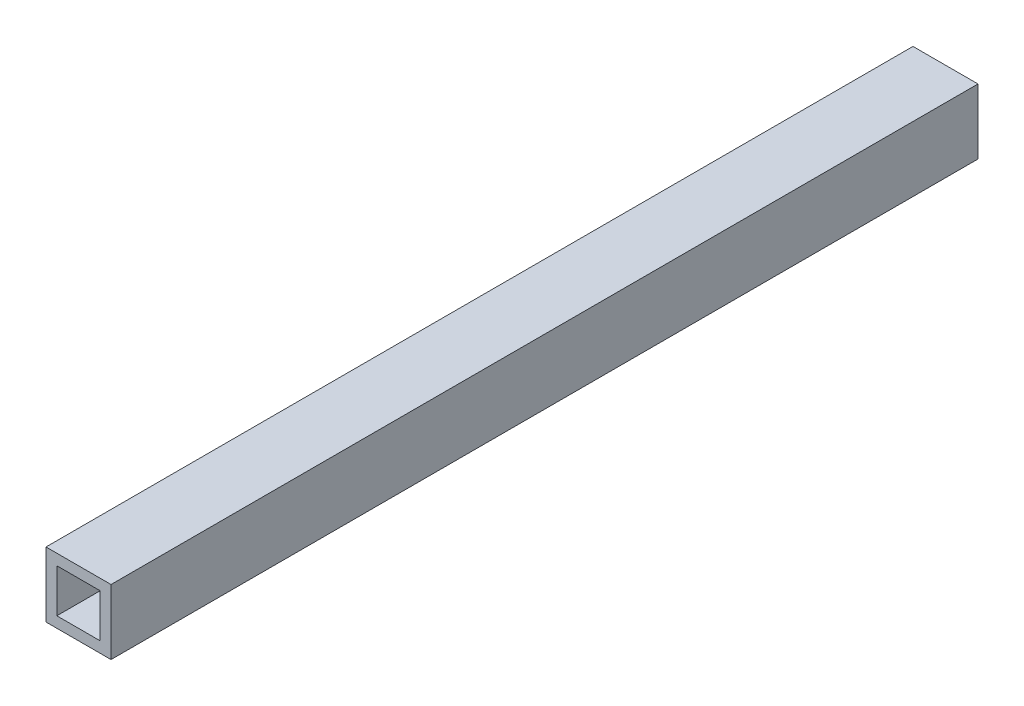
from build123d import *

# Parameters (mm, degrees)
SKETCH1_W           = 30
SKETCH1_H           = 30
SKETCH1_W_2         = 20
SKETCH1_H_2         = 20
BOSS_EXTRUDE1_DEPTH = 400


with BuildPart() as part:
    # Sketch1 → Boss-Extrude1 (new body)
    with BuildSketch(Plane.XY):
        Rectangle(SKETCH1_W, SKETCH1_H)
        Rectangle(SKETCH1_W_2, SKETCH1_H_2, mode=Mode.SUBTRACT)
    extrude(amount=BOSS_EXTRUDE1_DEPTH)


solid = part.part
